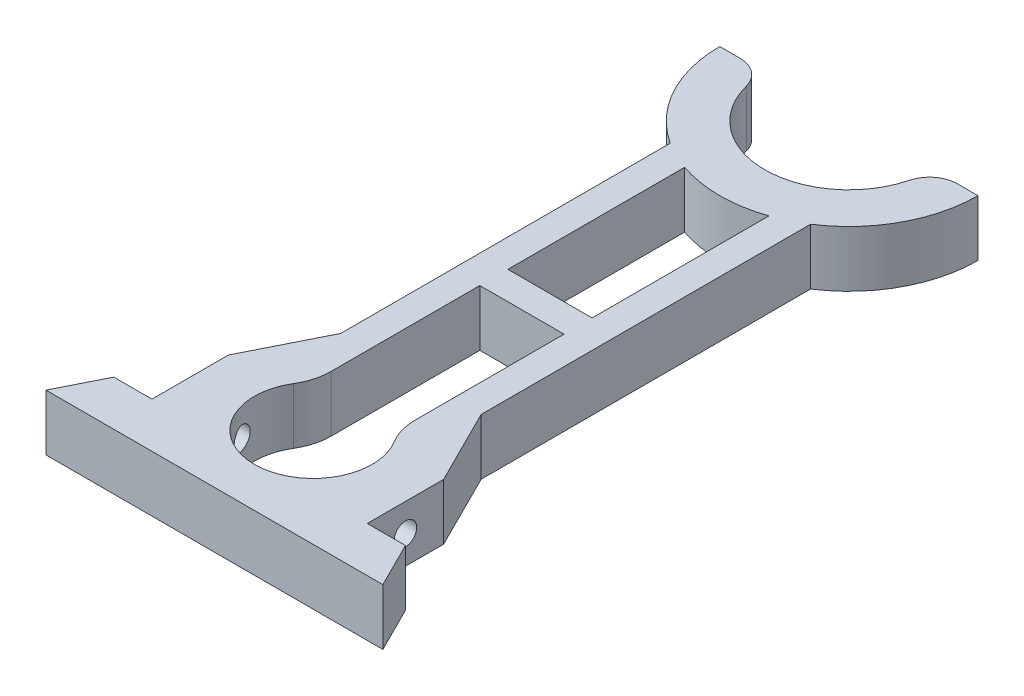
from build123d import *

# Parameters (mm, degrees)
BOSS_EXTRUDE1_DEPTH = 10
FILLET1_R           = 10
FILLET2_R           = 5
CUT_EXTRUDE1_DEPTH  = 10
SKETCH7_R           = 2
CUT_EXTRUDE2_DEPTH  = 43
SKETCH8_W           = 15
SKETCH8_H           = 5
BOSS_EXTRUDE3_DEPTH = 10


with BuildPart() as part:
    # Sketch1 → Boss-Extrude1 (new body)
    with BuildSketch(Plane(origin=(0, 0, 0), x_dir=(1, 0, 0), z_dir=(0, 1, 0))):
        with BuildLine():
            Line((12.5, -23), (12.5, -19.306734576))
            ThreePointArc((12.5, -19.306734576), (20.205197351, -10.988630488), (23, 0))
            Line((23, 0), (15, 0))
            ThreePointArc((15, 0), (0, -15), (-15, 0))
            Line((-15, 0), (-23, 0))
            ThreePointArc((-23, 0), (-20.205197351, -10.988630488), (-12.5, -19.306734576))
            Line((-12.5, -19.306734576), (-12.5, -23))
            Line((-12.5, -23), (-12.5, -78))
            Line((-12.5, -78), (-30, -113))
            Line((-30, -113), (-12.5, -113))
            Line((-12.5, -113), (12.5, -113))
            Line((12.5, -113), (30, -113))
            Line((30, -113), (12.5, -78))
            Line((12.5, -78), (12.5, -23))
        make_face()
        with BuildLine():
            ThreePointArc((-7.5, -88.04908974), (0, -105.897558969), (7.5, -88.04908974))
            Line((7.5, -88.04908974), (7.5, -33.180945535))
            Line((7.5, -33.180945535), (7.5, -21.742814905))
            ThreePointArc((7.5, -21.742814905), (0, -23), (-7.5, -21.742814905))
            Line((-7.5, -21.742814905), (-7.5, -33.180945535))
            Line((-7.5, -33.180945535), (-7.5, -88.04908974))
        make_face(mode=Mode.SUBTRACT)
    extrude(amount=BOSS_EXTRUDE1_DEPTH)

    # Fillet1
    fillet1_edges = [part.edges().sort_by_distance(p)[0] for p in [
        (7.5, 5, 88.04908974),
        (-7.5, 5, 88.04908974),
    ]]
    fillet(fillet1_edges, radius=FILLET1_R)

    # Fillet2
    fillet2_edges = [part.edges().sort_by_distance(p)[0] for p in [
        (-15, 5, 0),
        (15, 5, 0),
    ]]
    fillet(fillet2_edges, radius=FILLET2_R)

    # Sketch6 → Cut-Extrude1 (cut)
    with BuildSketch(Plane(origin=(0, 10, 0), x_dir=(1, 0, 0), z_dir=(0, 1, 0))):
        Polygon((25.97702769, -104.95405538), (19.174519353, -91.349038706), (19.174519353, -104.95405538), align=None)
        Polygon((-19.174519353, -104.95405538), (-19.174519353, -91.349038706), (-25.97702769, -104.95405538), align=None)
    extrude(amount=-CUT_EXTRUDE1_DEPTH, mode=Mode.SUBTRACT)

    # Sketch7 → Cut-Extrude2 (cut)
    with BuildSketch(Plane(origin=(19.174519353, 0, 0), x_dir=(0, 0, -1), z_dir=(1, 0, 0))):
        with Locations((-98.151547043, 5)):
            Circle(SKETCH7_R)
    extrude(amount=-CUT_EXTRUDE2_DEPTH, mode=Mode.SUBTRACT)

    # Sketch8 → Boss-Extrude3 (add)
    with BuildSketch(Plane(origin=(0, 10, 0), x_dir=(1, 0, 0), z_dir=(0, 1, 0))):
        with Locations((0, -55.731647811)):
            Rectangle(SKETCH8_W, SKETCH8_H)
    extrude(amount=-BOSS_EXTRUDE3_DEPTH)


solid = part.part
